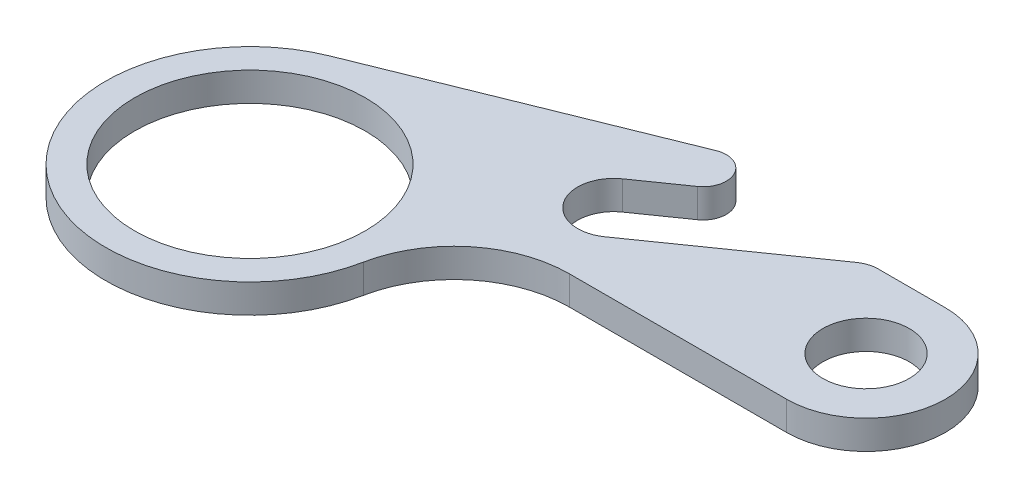
from build123d import *

# Parameters (mm, degrees)
SKETCH1_R           = 4.7625
SKETCH1_R_2         = 12.7
BOSS_EXTRUDE1_DEPTH = 3.175
SCALE1_SCALE        = 0.6


with BuildPart() as part:
    # Sketch1 → Boss-Extrude1 (new body)
    with BuildSketch(Plane(origin=(0, 0, 0), x_dir=(1, 0, 0), z_dir=(0, 1, 0))):
        with BuildLine():
            Line((0, -8.73125), (-23.925972084, -8.73125))
            ThreePointArc((-23.925972084, -8.73125), (-31.985998621, -11.616670426), (-36.383573946, -18.961805556))
            ThreePointArc((-36.383573946, -18.961805556), (-62.075355484, -28.106340634), (-57.903987761, -1.156575296))
            Line((-57.903987761, -1.156575296), (-27.611137885, 11.086197953))
            ThreePointArc((-27.611137885, 11.086197953), (-24.427259651, 9.943349405), (-25.202507899, 6.650603808))
            Line((-25.202507899, 6.650603808), (-30.057631482, 3.251009676))
            ThreePointArc((-30.057631482, 3.251009676), (-31.032259676, -2.276381482), (-25.504868518, -3.251009676))
            Line((-25.504868518, -3.251009676), (-9.212459777, 8.157057741))
            ThreePointArc((-9.212459777, 8.157057741), (-8.346095505, 8.584301319), (-7.391354591, 8.73125))
            Line((-7.391354591, 8.73125), (0, 8.73125))
            ThreePointArc((0, 8.73125), (8.73125, 0), (0, -8.73125))
        make_face()
        with Locations(Location((0, 0, 0), (0, 0, 270))):
            Circle(SKETCH1_R, mode=Mode.SUBTRACT)
        with Locations(Location((-51.955576272, -15.875, 0), (0, 0, 270))):
            Circle(SKETCH1_R_2, mode=Mode.SUBTRACT)
    extrude(amount=BOSS_EXTRUDE1_DEPTH)


with BuildPart() as part_1:
    # Scale1: scaled about (-29.432275391, 1.5875, 5.297099312)
    add(part.part.scale(SCALE1_SCALE).moved(Location((-11.772910156, 0.635, 2.118839725))))


solid = part_1.part
